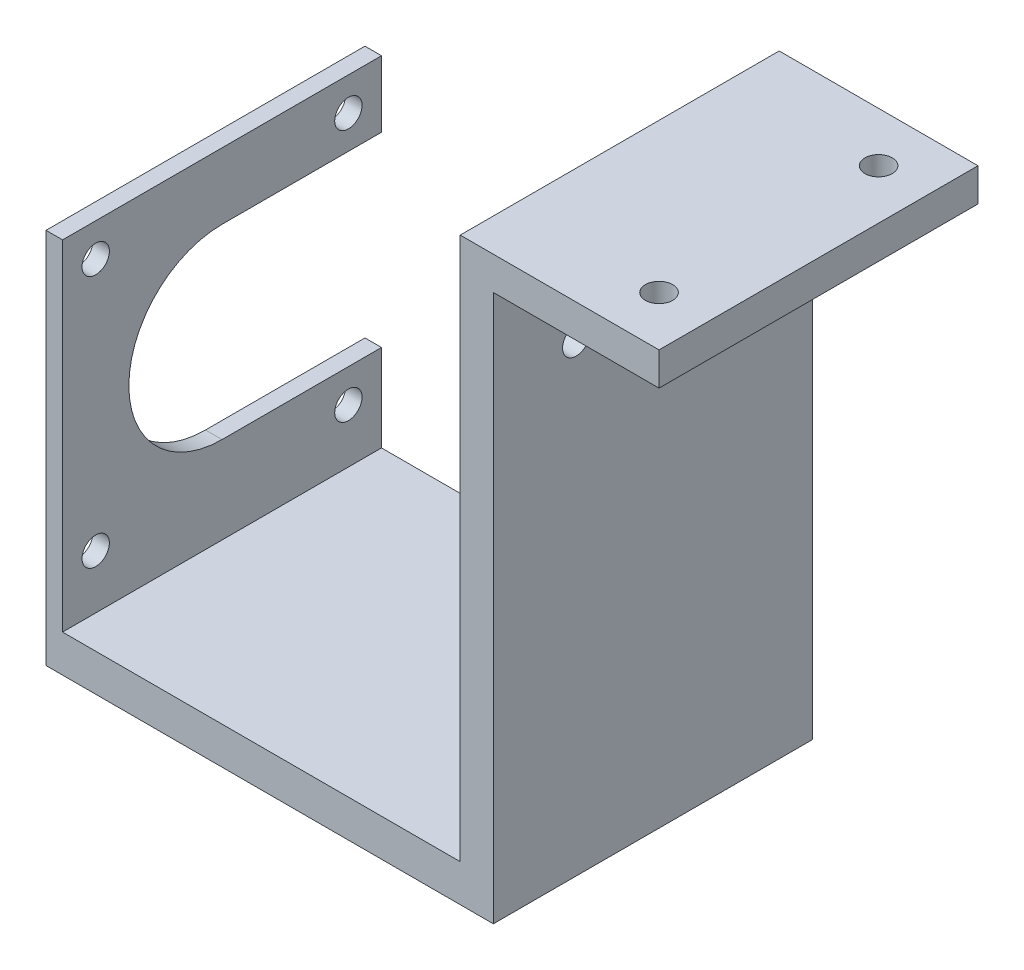
from build123d import *

# Parameters (mm, degrees)
SKETCH1_W                 = 13
SKETCH1_H                 = 16
BOSS_EXTRUDE1_DEPTH       = 4
SKETCH2_R                 = 1.65
CUT_EXTRUDE1_DEPTH        = 10
SKETCH3_W                 = 4
SKETCH3_H                 = 13
BOSS_EXTRUDE2_DEPTH       = 4
SKETCH4_W                 = 13
SKETCH4_H                 = 4
BOSS_EXTRUDE3_DEPTH       = 60
SKETCH6_W                 = 4
SKETCH6_H                 = 21
SKETCH6_H_2               = 13
BOSS_EXTRUDE4_DEPTH       = 28
SKETCH12_W                = 4
SKETCH12_H                = 28
BOSS_EXTRUDE8_DEPTH       = 1.65
SKETCH13_W                = 4
SKETCH13_H                = 28
BOSS_EXTRUDE9_DEPTH       = 1.65
SKETCH14_W                = 4
SKETCH14_H                = 35.878399396
CUT_EXTRUDE5_DEPTH        = 24
SKETCH15_R                = 1.65
CUT_EXTRUDE6_DEPTH        = 24
SKETCH16_W                = 4
SKETCH16_H                = 11.121600604
SKETCH16_H_2              = 11.3
BOSS_EXTRUDE10_DEPTH      = 29.15
SKETCH17_R                = 1.65
CUT_EXTRUDE8_DEPTH        = 29.15
SKETCH18_W                = 22.65
SKETCH18_H                = 4
SKETCH18_W_2              = 13
BOSS_EXTRUDE11_DEPTH      = 4
SKETCH19_W                = 4
SKETCH19_H                = 20
BOSS_EXTRUDE12_DEPTH      = 40
SKETCH20_R                = 1.65
CUT_EXTRUDE9_DEPTH        = 40
SKETCH21_W                = 4
SKETCH21_H                = 30.5
BOSS_EXTRUDE13_DEPTH      = 38.5
SKETCH23_W                = 4
SKETCH23_H                = 4
BOSS_EXTRUDE14_DEPTH      = 38.5
SKETCH24_W                = 4
SKETCH24_H                = 38.5
BOSS_EXTRUDE15_DEPTH      = 3
SKETCH27_W                = 4
SKETCH27_H                = 58.3
CUT_EXTRUDE10_DEPTH       = 100
BOSS_EXTRUDE16_DEPTH      = 40
BOSS_EXTRUDE16_DEPTH_BACK = 28
SKETCH29_W                = 38.5
SKETCH29_H                = 7
SKETCH30_R                = 1.65
CUT_EXTRUDE11_DEPTH       = 40
SKETCH31_W                = 4
SKETCH31_H                = 22.5
CUT_EXTRUDE12_DEPTH       = 38.5
SKETCH32_W                = 38.5
SKETCH32_H                = 2.5
CUT_EXTRUDE13_DEPTH       = 40
SKETCH33_W                = 4
SKETCH33_H                = 8
BOSS_EXTRUDE17_DEPTH      = 8
SKETCH34_R                = 1.65
CUT_EXTRUDE14_DEPTH       = 8
SKETCH35_W                = 4
SKETCH35_H                = 43.5
BOSS_EXTRUDE18_DEPTH      = 13
CUT_EXTRUDE15_START       = -20
SKETCH36_W                = 10
SKETCH36_H                = 80
CUT_EXTRUDE15_DEPTH       = 20
SKETCH37_W                = 5
SKETCH37_H                = 7
BOSS_EXTRUDE19_DEPTH      = 4
SKETCH41_W                = 13
SKETCH41_H                = 20
BOSS_EXTRUDE20_DEPTH      = 4
SKETCH42_R                = 1.65
CUT_EXTRUDE18_DEPTH       = 4
SKETCH43_W                = 4
SKETCH43_H                = 38.5
CUT_EXTRUDE19_DEPTH       = 10
SKETCH44_W                = 8
SKETCH44_H                = 9
BOSS_EXTRUDE21_DEPTH      = 4
SKETCH45_R                = 1.65
CUT_EXTRUDE20_DEPTH       = 4
CUT_EXTRUDE21_DEPTH       = 3
SKETCH49_R                = 1.65
CUT_EXTRUDE22_DEPTH       = 5
SKETCH54_W                = 1
SKETCH54_H                = 38.5
CUT_EXTRUDE24_DEPTH       = 50
SKETCH55_W                = 8
SKETCH55_H                = 10
BOSS_EXTRUDE22_DEPTH      = 4
SKETCH56_R                = 1.65
CUT_EXTRUDE25_DEPTH       = 4
CUT_EXTRUDE26_DEPTH       = 15
CUT_EXTRUDE26_DEPTH_BACK  = 10
SKETCH57_W                = 25
SKETCH57_H                = 70
SKETCH58_W                = 47.5
SKETCH58_H                = 38.5
BOSS_EXTRUDE24_DEPTH      = 4.5
SKETCH59_W                = 0.5
SKETCH59_H                = 38.5
BOSS_EXTRUDE25_DEPTH      = 4.5
SKETCH60_W                = 4
SKETCH60_H                = 38.5
BOSS_EXTRUDE26_DEPTH      = 69.5
SKETCH61_W                = 38.5
SKETCH61_H                = 2.457662878
BOSS_EXTRUDE27_DEPTH      = 20
SKETCH62_W                = 38.5
SKETCH62_H                = 2
BOSS_EXTRUDE31_DEPTH      = 29.5
SKETCH64_W                = 4
SKETCH64_H                = 13
BOSS_EXTRUDE32_DEPTH      = 16
SKETCH65_R                = 1.65
CUT_EXTRUDE27_DEPTH       = 16
SKETCH66_W                = 24
SKETCH66_H                = 0.5
BOSS_EXTRUDE33_DEPTH      = 38.5
SKETCH69_W                = 20
SKETCH69_H                = 38.5
BOSS_EXTRUDE34_DEPTH      = 1.04
SKETCH70_R                = 1.65
CUT_EXTRUDE29_DEPTH       = 10
SKETCH72_W                = 2
SKETCH72_H                = 38.5
CUT_EXTRUDE31_DEPTH       = 60
SKETCH73_W                = 22.5
SKETCH73_H                = 38.5
BOSS_EXTRUDE35_DEPTH      = 2
SKETCH74_R                = 11.25
CUT_EXTRUDE32_DEPTH       = 2
CUT_EXTRUDE33_DEPTH       = 2
SKETCH76_R                = 1.65
CUT_EXTRUDE34_DEPTH       = 5
SKETCH77_W                = 35
SKETCH77_H                = 30
CUT_EXTRUDE35_DEPTH       = 1000


with BuildPart() as part:
    # Sketch1 → Boss-Extrude1 (new body)
    with BuildSketch(Plane(origin=(0, 0, 0), x_dir=(0, 0, -1), z_dir=(1, 0, 0))):
        with Locations((6.5, -8)):
            Rectangle(SKETCH1_W, SKETCH1_H)
    extrude(amount=BOSS_EXTRUDE1_DEPTH)

    # Sketch2 → Cut-Extrude1 (cut)
    with BuildSketch(Plane(origin=(4, 0, 0), x_dir=(0, 0, -1), z_dir=(1, 0, 0))):
        with Locations((6.5, -4)):
            Circle(SKETCH2_R)
        with Locations((6.5, -12)):
            Circle(SKETCH2_R)
    extrude(amount=-CUT_EXTRUDE1_DEPTH, mode=Mode.SUBTRACT)

    # Sketch3 → Boss-Extrude2 (add)
    with BuildSketch(Plane.XZ.offset(16)):
        with Locations((2, -6.5)):
            Rectangle(SKETCH3_W, SKETCH3_H)
    extrude(amount=BOSS_EXTRUDE2_DEPTH)

    # Sketch4 → Boss-Extrude3 (add)
    with BuildSketch(Plane(origin=(4, 0, 0), x_dir=(0, 0, -1), z_dir=(1, 0, 0))):
        with Locations((6.5, -18)):
            Rectangle(SKETCH4_W, SKETCH4_H)
    extrude(amount=BOSS_EXTRUDE3_DEPTH)

    # Sketch6 → Boss-Extrude4 (add)
    with BuildSketch(Plane(origin=(0, -16, 0), x_dir=(1, 0, 0), z_dir=(0, 1, 0))):
        with Locations((62, -10.5)):
            Rectangle(SKETCH6_W, SKETCH6_H)
        with Locations((62, 23.5)):
            Rectangle(SKETCH6_W, SKETCH6_H)
        with Locations((62, 6.5)):
            Rectangle(SKETCH6_W, SKETCH6_H_2)
    extrude(amount=BOSS_EXTRUDE4_DEPTH)

    # Sketch12 → Boss-Extrude8 (add)
    with BuildSketch(Plane(origin=(0, 0, -34), x_dir=(-1, 0, 0), z_dir=(0, 0, -1))):
        with Locations((-62, -2)):
            Rectangle(SKETCH12_W, SKETCH12_H)
    extrude(amount=BOSS_EXTRUDE8_DEPTH)

    # Sketch13 → Boss-Extrude9 (add)
    with BuildSketch(Plane.XY.offset(21)):
        with Locations((62, -2)):
            Rectangle(SKETCH13_W, SKETCH13_H)
    extrude(amount=BOSS_EXTRUDE9_DEPTH)

    # Sketch14 → Cut-Extrude5 (cut)
    with BuildSketch(Plane(origin=(0, 12, 0), x_dir=(1, 0, 0), z_dir=(0, 1, 0))):
        with Locations((62, 6.410800302)):
            Rectangle(SKETCH14_W, SKETCH14_H)
    extrude(amount=-CUT_EXTRUDE5_DEPTH, mode=Mode.SUBTRACT)

    # Sketch15 → Cut-Extrude6 (cut)
    with BuildSketch(Plane(origin=(64, 0, 0), x_dir=(0, 0, -1), z_dir=(1, 0, 0))):
        with Locations((-17, -11.5)):
            Circle(SKETCH15_R)
        with Locations((30, -11.5)):
            Circle(SKETCH15_R)
    extrude(amount=-CUT_EXTRUDE6_DEPTH, mode=Mode.SUBTRACT)

    # Sketch16 → Boss-Extrude10 (add)
    with BuildSketch(Plane(origin=(0, 12, 0), x_dir=(1, 0, 0), z_dir=(0, 1, 0))):
        with Locations((62, -17.089199698)):
            Rectangle(SKETCH16_W, SKETCH16_H)
        with Locations((62, 30)):
            Rectangle(SKETCH16_W, SKETCH16_H_2)
    extrude(amount=BOSS_EXTRUDE10_DEPTH)

    # Sketch17 → Cut-Extrude8 (cut)
    with BuildSketch(Plane(origin=(64, 0, 0), x_dir=(0, 0, -1), z_dir=(1, 0, 0))):
        with Locations((-17, 35.5)):
            Circle(SKETCH17_R)
        with Locations((30, 35.5)):
            Circle(SKETCH17_R)
    extrude(amount=-CUT_EXTRUDE8_DEPTH, mode=Mode.SUBTRACT)

    # Sketch18 → Boss-Extrude11 (add)
    with BuildSketch(Plane(origin=(64, 0, 0), x_dir=(0, 0, -1), z_dir=(1, 0, 0))):
        with Locations((-11.325, -18)):
            Rectangle(SKETCH18_W, SKETCH18_H)
        with Locations((24.325, -18)):
            Rectangle(SKETCH18_W, SKETCH18_H)
        with Locations((6.5, -18)):
            Rectangle(SKETCH18_W_2, SKETCH18_H)
    extrude(amount=-BOSS_EXTRUDE11_DEPTH)

    # Sketch19 → Boss-Extrude12 (add)
    with BuildSketch(Plane(origin=(0, 0, -13), x_dir=(-1, 0, 0), z_dir=(0, 0, -1))):
        with Locations((-2, -10)):
            Rectangle(SKETCH19_W, SKETCH19_H)
    extrude(amount=BOSS_EXTRUDE12_DEPTH)

    # Sketch20 → Cut-Extrude9 (cut)
    with BuildSketch(Plane.ZY):
        with Locations((-46.5, -4)):
            Circle(SKETCH20_R)
        with Locations((-46.5, -12)):
            Circle(SKETCH20_R)
    extrude(amount=-CUT_EXTRUDE9_DEPTH, mode=Mode.SUBTRACT)

    # Sketch21 → Boss-Extrude13 (add)
    with BuildSketch(Plane(origin=(0, -16, 0), x_dir=(1, 0, 0), z_dir=(0, 1, 0))):
        with Locations((26, 6.5)):
            Rectangle(SKETCH21_W, SKETCH21_H)
    extrude(amount=BOSS_EXTRUDE13_DEPTH)

    # Sketch23 → Boss-Extrude14 (add)
    with BuildSketch(Plane(origin=(0, 22.5, 0), x_dir=(1, 0, 0), z_dir=(0, 1, 0))):
        with Locations((26, 23.75)):
            Rectangle(SKETCH23_W, SKETCH23_H)
        with Locations((26, -10.75)):
            Rectangle(SKETCH23_W, SKETCH23_H)
    extrude(amount=-BOSS_EXTRUDE14_DEPTH)

    # Sketch24 → Boss-Extrude15 (add)
    with BuildSketch(Plane(origin=(0, 22.5, 0), x_dir=(1, 0, 0), z_dir=(0, 1, 0))):
        with Locations((26, 6.5)):
            Rectangle(SKETCH24_W, SKETCH24_H)
    extrude(amount=BOSS_EXTRUDE15_DEPTH)

    # Sketch27 → Cut-Extrude10 (cut)
    with BuildSketch(Plane.XZ.offset(20)):
        with Locations((62, -6.5)):
            Rectangle(SKETCH27_W, SKETCH27_H)
    extrude(amount=-CUT_EXTRUDE10_DEPTH, mode=Mode.SUBTRACT)

    # Sketch29 → Boss-Extrude16 (add, two sides: drawn at the far end of the back side and taken through both)
    with BuildSketch(Plane(origin=(28, 0, 0), x_dir=(0, 0, -1), z_dir=(1, 0, 0)).offset(-BOSS_EXTRUDE16_DEPTH_BACK)):
        with Locations((6.5, -16.5)):
            Rectangle(SKETCH29_W, SKETCH29_H)
    extrude(amount=BOSS_EXTRUDE16_DEPTH + BOSS_EXTRUDE16_DEPTH_BACK)

    # Sketch30 → Cut-Extrude11 (cut)
    with BuildSketch(Plane.ZY.offset(-24)):
        with Locations((8.75, 21.5)):
            Circle(SKETCH30_R)
        with Locations((8.75, -9)):
            Circle(SKETCH30_R)
        with Locations((-21.75, 21.5)):
            Circle(SKETCH30_R)
        with Locations((-21.75, -9)):
            Circle(SKETCH30_R)
    extrude(amount=-CUT_EXTRUDE11_DEPTH, mode=Mode.SUBTRACT)

    # Sketch31 → Cut-Extrude12 (cut)
    with BuildSketch(Plane(origin=(0, 25.5, 0), x_dir=(1, 0, 0), z_dir=(0, 1, 0))):
        with Locations((26, 6.5)):
            Rectangle(SKETCH31_W, SKETCH31_H)
    extrude(amount=-CUT_EXTRUDE12_DEPTH, mode=Mode.SUBTRACT)

    # Sketch32 → Cut-Extrude13 (cut)
    with BuildSketch(Plane(origin=(68, 0, 0), x_dir=(0, 0, -1), z_dir=(1, 0, 0))):
        with Locations((6.5, -14.25)):
            Rectangle(SKETCH32_W, SKETCH32_H)
    extrude(amount=-CUT_EXTRUDE13_DEPTH, mode=Mode.SUBTRACT)

    # Sketch33 → Boss-Extrude17 (add)
    with BuildSketch(Plane(origin=(0, 25.5, 0), x_dir=(1, 0, 0), z_dir=(0, 1, 0))):
        with Locations((26, -8.75)):
            Rectangle(SKETCH33_W, SKETCH33_H)
        with Locations((26, 21.75)):
            Rectangle(SKETCH33_W, SKETCH33_H)
    extrude(amount=-BOSS_EXTRUDE17_DEPTH)

    # Sketch34 → Cut-Extrude14 (cut)
    with BuildSketch(Plane(origin=(28, 0, 0), x_dir=(0, 0, -1), z_dir=(1, 0, 0))):
        with Locations((-8.75, 21.5)):
            Circle(SKETCH34_R)
        with Locations((21.75, 21.5)):
            Circle(SKETCH34_R)
    extrude(amount=-CUT_EXTRUDE14_DEPTH, mode=Mode.SUBTRACT)

    # Sketch35 → Boss-Extrude18 (add)
    with BuildSketch(Plane(origin=(0, -13, 0), x_dir=(1, 0, 0), z_dir=(0, 1, 0))):
        with Locations((12, 9)):
            Rectangle(SKETCH35_W, SKETCH35_H)
    extrude(amount=BOSS_EXTRUDE18_DEPTH)

    # Sketch36 → Cut-Extrude15 (cut)
    with BuildSketch(Plane.XZ.offset(20).offset(CUT_EXTRUDE15_START)):
        with Locations((5, -27.25)):
            Rectangle(SKETCH36_W, SKETCH36_H)
    extrude(amount=CUT_EXTRUDE15_DEPTH, mode=Mode.SUBTRACT)

    # Sketch37 → Boss-Extrude19 (add)
    with BuildSketch(Plane.ZY.offset(-10)):
        with Locations((-28.25, -16.5)):
            Rectangle(SKETCH37_W, SKETCH37_H)
    extrude(amount=-BOSS_EXTRUDE19_DEPTH)

    # Sketch41 → Boss-Extrude20 (add)
    with BuildSketch(Plane(origin=(14, 0, 0), x_dir=(0, 0, -1), z_dir=(1, 0, 0))):
        with Locations((32.25, -10)):
            Rectangle(SKETCH41_W, SKETCH41_H)
    extrude(amount=-BOSS_EXTRUDE20_DEPTH)

    # Sketch42 → Cut-Extrude18 (cut)
    with BuildSketch(Plane.ZY.offset(-10)):
        with Locations((-32.25, -4)):
            Circle(SKETCH42_R)
        with Locations((-32.25, -12)):
            Circle(SKETCH42_R)
    extrude(amount=-CUT_EXTRUDE18_DEPTH, mode=Mode.SUBTRACT)

    # Sketch43 → Cut-Extrude19 (cut)
    with BuildSketch(Plane(origin=(0, 0, 0), x_dir=(1, 0, 0), z_dir=(0, 1, 0))):
        with Locations((12, 6.5)):
            Rectangle(SKETCH43_W, SKETCH43_H)
    extrude(amount=-CUT_EXTRUDE19_DEPTH, mode=Mode.SUBTRACT)

    # Sketch44 → Boss-Extrude21 (add)
    with BuildSketch(Plane(origin=(28, 0, 0), x_dir=(0, 0, -1), z_dir=(1, 0, 0))):
        with Locations((-8.75, -11)):
            Rectangle(SKETCH44_W, SKETCH44_H)
        with Locations((21.75, -11)):
            Rectangle(SKETCH44_W, SKETCH44_H)
    extrude(amount=-BOSS_EXTRUDE21_DEPTH)

    # Sketch45 → Cut-Extrude20 (cut)
    with BuildSketch(Plane.ZY.offset(-24)):
        with Locations((-21.75, -7)):
            Circle(SKETCH45_R)
        with Locations((8.75, -7)):
            Circle(SKETCH45_R)
    extrude(amount=-CUT_EXTRUDE20_DEPTH, mode=Mode.SUBTRACT)

    # Sketch46 → Cut-Extrude21 (cut)
    with BuildSketch(Plane(origin=(0, -15.5, 0), x_dir=(1, 0, 0), z_dir=(0, 1, 0))):
        Polygon((64, 18.285898385), (67, 20.017949192), (67, 23.482050808), (64, 25.214101615), (61, 23.482050808), (61, 20.017949192), align=None)
        Polygon((64, -12.214101615), (67, -10.482050808), (67, -7.017949192), (64, -5.285898385), (61, -7.017949192), (61, -10.482050808), align=None)
    extrude(amount=-CUT_EXTRUDE21_DEPTH, mode=Mode.SUBTRACT)

    # Sketch49 → Cut-Extrude22 (cut)
    with BuildSketch(Plane(origin=(0, -15.5, 0), x_dir=(1, 0, 0), z_dir=(0, 1, 0))):
        with Locations(Location((64, 21.75, 0), (0, 0, 270))):
            Circle(SKETCH49_R)
        with Locations(Location((64, -8.75, 0), (0, 0, 270))):
            Circle(SKETCH49_R)
    extrude(amount=-CUT_EXTRUDE22_DEPTH, mode=Mode.SUBTRACT)

    # Sketch54 → Cut-Extrude24 (cut)
    with BuildSketch(Plane(origin=(0, -10, 0), x_dir=(1, 0, 0), z_dir=(0, 1, 0))):
        with Locations((10.5, 6.5)):
            Rectangle(SKETCH54_W, SKETCH54_H)
    extrude(amount=-CUT_EXTRUDE24_DEPTH, mode=Mode.SUBTRACT)

    # Sketch55 → Boss-Extrude22 (add)
    with BuildSketch(Plane.ZY.offset(-24)):
        with Locations((8.75, -8)):
            Rectangle(SKETCH55_W, SKETCH55_H)
        with Locations((-21.75, -8)):
            Rectangle(SKETCH55_W, SKETCH55_H)
    extrude(amount=-BOSS_EXTRUDE22_DEPTH)

    # Sketch56 → Cut-Extrude25 (cut)
    with BuildSketch(Plane.ZY.offset(-24)):
        with Locations((-21.75, -9)):
            Circle(SKETCH56_R)
        with Locations((8.75, -9)):
            Circle(SKETCH56_R)
    extrude(amount=-CUT_EXTRUDE25_DEPTH, mode=Mode.SUBTRACT)

    # Sketch57 → Cut-Extrude26 (cut, two sides: drawn at the far end of the back side and taken through both)
    with BuildSketch(Plane(origin=(0, -13, 0), x_dir=(1, 0, 0), z_dir=(0, 1, 0)).offset(-CUT_EXTRUDE26_DEPTH_BACK)):
        with Locations((11.5, 22.25)):
            Rectangle(SKETCH57_W, SKETCH57_H)
    extrude(amount=CUT_EXTRUDE26_DEPTH + CUT_EXTRUDE26_DEPTH_BACK, mode=Mode.SUBTRACT)

    # Sketch58 → Boss-Extrude24 (add)
    with BuildSketch(Plane.XZ.offset(20)):
        with Locations((51.75, -6.5)):
            Rectangle(SKETCH58_W, SKETCH58_H)
    extrude(amount=-BOSS_EXTRUDE24_DEPTH)

    # Sketch59 → Boss-Extrude25 (add)
    with BuildSketch(Plane.XZ.offset(20)):
        with Locations((75.75, -6.5)):
            Rectangle(SKETCH59_W, SKETCH59_H)
    extrude(amount=-BOSS_EXTRUDE25_DEPTH)

    # Sketch60 → Boss-Extrude26 (add)
    with BuildSketch(Plane.XZ.offset(20)):
        with Locations((78, -6.5)):
            Rectangle(SKETCH60_W, SKETCH60_H)
    extrude(amount=-BOSS_EXTRUDE26_DEPTH)

    # Sketch61 → Boss-Extrude27 (add)
    with BuildSketch(Plane(origin=(80, 0, 0), x_dir=(0, 0, -1), z_dir=(1, 0, 0))):
        with Locations((6.5, 48.271168561)):
            Rectangle(SKETCH61_W, SKETCH61_H)
    extrude(amount=BOSS_EXTRUDE27_DEPTH)

    # Sketch62 → Boss-Extrude31 (add)
    with BuildSketch(Plane.ZY.offset(-76)):
        with Locations((-6.5, 29)):
            Rectangle(SKETCH62_W, SKETCH62_H)
    extrude(amount=BOSS_EXTRUDE31_DEPTH)

    # Sketch64 → Boss-Extrude32 (add)
    with BuildSketch(Plane(origin=(0, 30, 0), x_dir=(1, 0, 0), z_dir=(0, 1, 0))):
        with Locations((48.5, 6.5)):
            Rectangle(SKETCH64_W, SKETCH64_H)
    extrude(amount=BOSS_EXTRUDE32_DEPTH)

    # Sketch65 → Cut-Extrude27 (cut)
    with BuildSketch(Plane.ZY.offset(-46.5)):
        with Locations((-6.5, 34)):
            Circle(SKETCH65_R)
        with Locations((-6.5, 42)):
            Circle(SKETCH65_R)
    extrude(amount=-CUT_EXTRUDE27_DEPTH, mode=Mode.SUBTRACT)

    # Sketch66 → Boss-Extrude33 (add)
    with BuildSketch(Plane(origin=(0, 0, -25.75), x_dir=(-1, 0, 0), z_dir=(0, 0, -1))):
        with Locations((-88, 49.75)):
            Rectangle(SKETCH66_W, SKETCH66_H)
    extrude(amount=-BOSS_EXTRUDE33_DEPTH)

    # Sketch69 → Boss-Extrude34 (add)
    with BuildSketch(Plane.XZ.offset(-47.042337122)):
        with Locations((90, -6.5)):
            Rectangle(SKETCH69_W, SKETCH69_H)
    extrude(amount=BOSS_EXTRUDE34_DEPTH)

    # Sketch70 → Cut-Extrude29 (cut)
    with BuildSketch(Plane.XZ.offset(-46.002337122)):
        with Locations(Location((94, 6.75, 0), (0, 0, 270))):
            Circle(SKETCH70_R)
        with Locations(Location((94, -19.75, 0), (0, 0, 270))):
            Circle(SKETCH70_R)
    extrude(amount=-CUT_EXTRUDE29_DEPTH, mode=Mode.SUBTRACT)

    # Sketch72 → Cut-Extrude31 (cut)
    with BuildSketch(Plane.XZ.offset(20)):
        with Locations((25, -6.5)):
            Rectangle(SKETCH72_W, SKETCH72_H)
    extrude(amount=-CUT_EXTRUDE31_DEPTH, mode=Mode.SUBTRACT)

    # Sketch73 → Boss-Extrude35 (add)
    with BuildSketch(Plane.ZY.offset(-26)):
        with Locations((-6.5, 6.25)):
            Rectangle(SKETCH73_W, SKETCH73_H)
    extrude(amount=-BOSS_EXTRUDE35_DEPTH)

    # Sketch74 → Cut-Extrude32 (cut)
    with BuildSketch(Plane.ZY.offset(-26)):
        with Locations((-6.5, 6.25)):
            Circle(SKETCH74_R)
    extrude(amount=-CUT_EXTRUDE32_DEPTH, mode=Mode.SUBTRACT)

    # Sketch75 → Cut-Extrude33 (cut)
    with BuildSketch(Plane.ZY.offset(-26)):
        with BuildLine():
            Line((-25.75, 6.25), (-17.75, 6.25))
            ThreePointArc((-17.75, 6.25), (-14.454951288, 14.204951288), (-6.5, 17.5))
            Line((-6.5, 17.5), (-25.75, 17.5))
            Line((-25.75, 17.5), (-25.75, 6.25))
        make_face()
        with BuildLine():
            ThreePointArc((-6.5, -5), (-14.454951288, -1.704951288), (-17.75, 6.25))
            Line((-17.75, 6.25), (-25.75, 6.25))
            Line((-25.75, 6.25), (-25.75, -5))
            Line((-25.75, -5), (-6.5, -5))
        make_face()
    extrude(amount=-CUT_EXTRUDE33_DEPTH, mode=Mode.SUBTRACT)

    # Sketch76 → Cut-Extrude34 (cut)
    with BuildSketch(Plane.ZY.offset(-76)):
        with Locations((2.75, 36)):
            Circle(SKETCH76_R)
        with Locations((-15.75, 36)):
            Circle(SKETCH76_R)
    extrude(amount=-CUT_EXTRUDE34_DEPTH, mode=Mode.SUBTRACT)

    # Sketch77 → Cut-Extrude35 (cut)
    with BuildSketch(Plane.XY.offset(12.75)):
        with Locations((58.5, 43)):
            Rectangle(SKETCH77_W, SKETCH77_H)
    extrude(amount=-CUT_EXTRUDE35_DEPTH, mode=Mode.SUBTRACT)


solid = part.part
